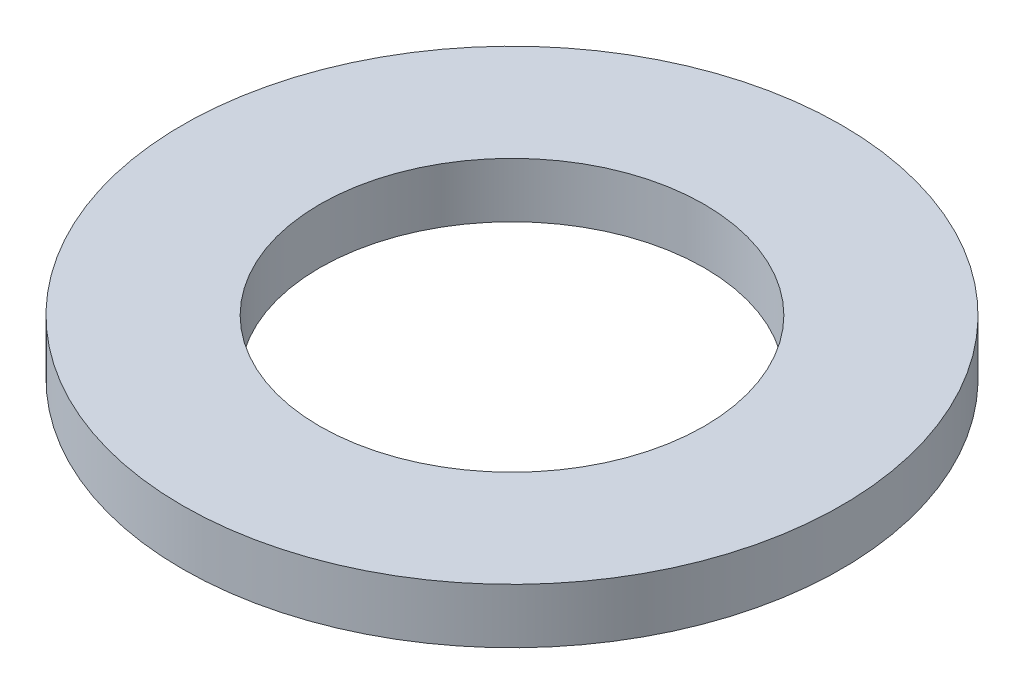
from build123d import *

# Parameters (mm, degrees)
SKETCH1_R           = 6
SKETCH1_R_2         = 3.5
BOSS_EXTRUDE1_DEPTH = 1


with BuildPart() as part:
    # Sketch1 → Boss-Extrude1 (new body)
    with BuildSketch(Plane(origin=(0, 0, 0), x_dir=(1, 0, 0), z_dir=(0, 1, 0))):
        with Locations(Location((0, 0, 0), (0, 0, 270))):
            Circle(SKETCH1_R)
        with Locations(Location((0, 0, 0), (0, 0, 270))):
            Circle(SKETCH1_R_2, mode=Mode.SUBTRACT)
    extrude(amount=BOSS_EXTRUDE1_DEPTH)


solid = part.part
